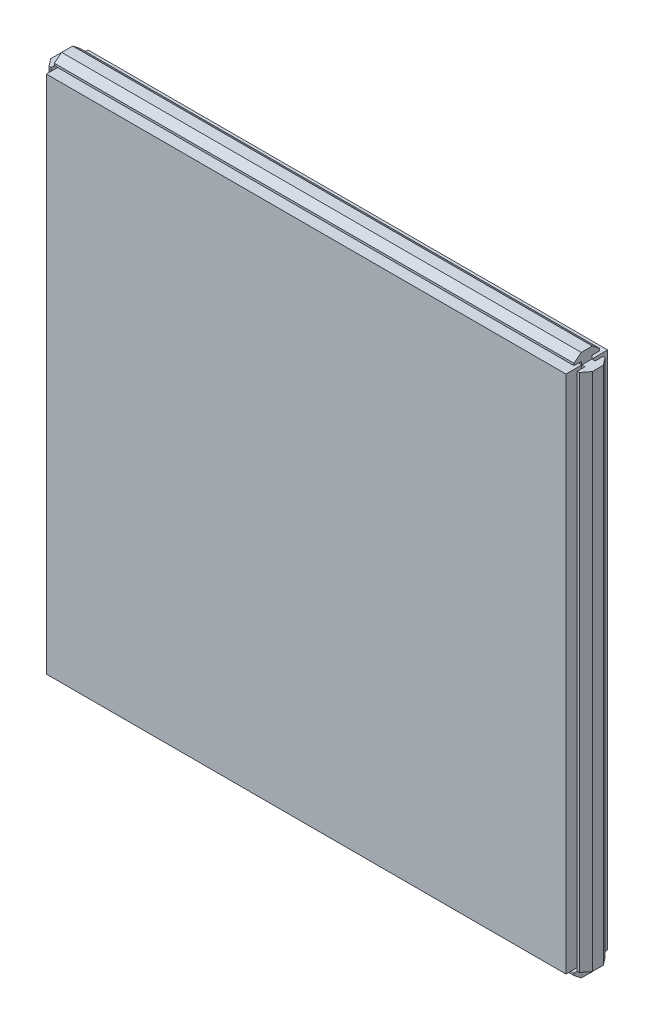
from build123d import *

# Parameters (mm, degrees)
BOSS_EXTRU_1_DEPTH           = 20
ENL_V_MAT_EXTRU_1_DEPTH      = 334.887542768
ENL_V_MAT_EXTRU_1_DEPTH_BACK = 249
ENL_V_MAT_EXTRU_2_DEPTH      = 334.887542768
ENL_V_MAT_EXTRU_2_DEPTH_BACK = 249
ENL_V_MAT_EXTRU_3_DEPTH      = 315.78213111
ENL_V_MAT_EXTRU_3_DEPTH_BACK = 249
ENL_V_MAT_EXTRU_4_DEPTH      = 315.78213111
ENL_V_MAT_EXTRU_4_DEPTH_BACK = 249
ENL_V_MAT_EXTRU_5_DEPTH      = 334.887542768
ENL_V_MAT_EXTRU_5_DEPTH_BACK = 249
ENL_V_MAT_EXTRU_6_DEPTH      = 334.887542768
ENL_V_MAT_EXTRU_6_DEPTH_BACK = 249
ENL_V_MAT_EXTRU_7_DEPTH      = 315.78213111
ENL_V_MAT_EXTRU_7_DEPTH_BACK = 249
ENL_V_MAT_EXTRU_8_DEPTH      = 315.78213111
ENL_V_MAT_EXTRU_8_DEPTH_BACK = 249


with BuildPart() as part:
    # Esquisse1 → Boss.-Extru.1 (new body)
    with BuildSketch(Plane.XY):
        Polygon((-179.143216373, 44.164624039), (69.856783627, 44.164624039), (69.856783627, 38.864624039), (75.156783627, 38.864624039), (75.156783627, -210.135375961), (69.856783627, -210.135375961), (69.856783627, -215.435375961), (-179.143216373, -215.435375961), (-179.143216373, -210.135375961), (-184.443216373, -210.135375961), (-184.443216373, 38.864624039), (-179.143216373, 38.864624039), align=None)
    extrude(amount=BOSS_EXTRU_1_DEPTH)

    # Esquisse2 → Enlèv. mat.-Extru.1 (cut, two sides: drawn at the far end of the back side and taken through both)
    with BuildSketch(Plane.ZY.offset(179.143216373).offset(-ENL_V_MAT_EXTRU_1_DEPTH_BACK)):
        Polygon((-529.816054004, 38.864624039), (0, 38.864624039), (7.55, 38.864624039), (7.55, 40.414624039), (3.85, 40.414624039), (3.85, 41.414624039), (7.35, 44.164624039), (423.954079466, 371.496400762), (75.014402763, 1372.026913212), (-878.755730707, 1039.395136489), align=None)
    extrude(amount=ENL_V_MAT_EXTRU_1_DEPTH + ENL_V_MAT_EXTRU_1_DEPTH_BACK, mode=Mode.SUBTRACT)

    # Esquisse3 → Enlèv. mat.-Extru.2 (cut, two sides: drawn at the far end of the back side and taken through both)
    with BuildSketch(Plane.ZY.offset(179.143216373).offset(-ENL_V_MAT_EXTRU_2_DEPTH_BACK)):
        Polygon((549.816054004, 38.864624039), (20, 38.864624039), (12.45, 38.864624039), (12.45, 40.414624039), (16.15, 40.414624039), (16.15, 41.414624039), (12.65, 44.164624039), (-403.954079466, 371.496400762), (-55.014402763, 1372.026913212), (898.755730707, 1039.395136489), align=None)
    extrude(amount=ENL_V_MAT_EXTRU_2_DEPTH + ENL_V_MAT_EXTRU_2_DEPTH_BACK, mode=Mode.SUBTRACT)

    # Esquisse5 → Enlèv. mat.-Extru.3 (cut, two sides: drawn at the far end of the back side and taken through both)
    with BuildSketch(Plane(origin=(0, -210.135375961, 0), x_dir=(-1, 0, 0), z_dir=(0, -1, 0)).offset(-ENL_V_MAT_EXTRU_3_DEPTH_BACK)):
        Polygon((179.143216373, 529.816054004), (179.143216373, 0), (179.143216373, -7.55), (180.693216373, -7.55), (180.693216373, -3.85), (181.693216373, -3.85), (184.443216373, -7.35), (511.774993096, -423.954079466), (1512.305505546, -75.014402763), (1179.673728823, 878.755730707), align=None)
    extrude(amount=ENL_V_MAT_EXTRU_3_DEPTH + ENL_V_MAT_EXTRU_3_DEPTH_BACK, mode=Mode.SUBTRACT)

    # Esquisse6 → Enlèv. mat.-Extru.4 (cut, two sides: drawn at the far end of the back side and taken through both)
    with BuildSketch(Plane(origin=(0, -210.135375961, 0), x_dir=(-1, 0, 0), z_dir=(0, -1, 0)).offset(-ENL_V_MAT_EXTRU_4_DEPTH_BACK)):
        Polygon((511.774993096, 403.954079466), (184.443216373, -12.65), (181.693216373, -16.15), (180.693216373, -16.15), (180.693216373, -12.45), (179.143216373, -12.45), (179.143216373, -20), (179.143216373, -549.816054004), (1179.673728823, -898.755730707), (1512.305505546, 55.014402763), align=None)
    extrude(amount=ENL_V_MAT_EXTRU_4_DEPTH + ENL_V_MAT_EXTRU_4_DEPTH_BACK, mode=Mode.SUBTRACT)

    # Esquisse8 → Enlèv. mat.-Extru.5 (cut, two sides: drawn at the far end of the back side and taken through both)
    with BuildSketch(Plane.ZY.offset(179.143216373).offset(-ENL_V_MAT_EXTRU_5_DEPTH_BACK)):
        Polygon((20, -210.135375961), (12.45, -210.135375961), (12.45, -211.685375961), (16.15, -211.685375961), (16.15, -212.685375961), (12.65, -215.435375961), (20, -215.435375961), align=None)
    extrude(amount=ENL_V_MAT_EXTRU_5_DEPTH + ENL_V_MAT_EXTRU_5_DEPTH_BACK, mode=Mode.SUBTRACT)

    # Esquisse9 → Enlèv. mat.-Extru.6 (cut, two sides: drawn at the far end of the back side and taken through both)
    with BuildSketch(Plane.ZY.offset(179.143216373).offset(-ENL_V_MAT_EXTRU_6_DEPTH_BACK)):
        Polygon((423.954079466, -542.767152684), (7.35, -215.435375961), (3.85, -212.685375961), (3.85, -211.685375961), (7.55, -211.685375961), (7.55, -210.135375961), (0, -210.135375961), (-529.816054004, -210.135375961), (-878.755730707, -1210.665888411), (75.014402763, -1543.297665134), align=None)
    extrude(amount=ENL_V_MAT_EXTRU_6_DEPTH + ENL_V_MAT_EXTRU_6_DEPTH_BACK, mode=Mode.SUBTRACT)

    # Esquisse11 → Enlèv. mat.-Extru.7 (cut, two sides: drawn at the far end of the back side and taken through both)
    with BuildSketch(Plane(origin=(0, 38.864624039, 0), x_dir=(1, 0, 0), z_dir=(0, 1, 0)).offset(-ENL_V_MAT_EXTRU_7_DEPTH_BACK)):
        Polygon((69.856783627, 0), (69.856783627, -7.55), (71.406783627, -7.55), (71.406783627, -3.85), (72.406783627, -3.85), (75.156783627, -7.35), (75.156783627, 0), align=None)
    extrude(amount=ENL_V_MAT_EXTRU_7_DEPTH + ENL_V_MAT_EXTRU_7_DEPTH_BACK, mode=Mode.SUBTRACT)

    # Esquisse12 → Enlèv. mat.-Extru.8 (cut, two sides: drawn at the far end of the back side and taken through both)
    with BuildSketch(Plane(origin=(0, 38.864624039, 0), x_dir=(1, 0, 0), z_dir=(0, 1, 0)).offset(-ENL_V_MAT_EXTRU_8_DEPTH_BACK)):
        Polygon((402.48856035, 403.954079466), (75.156783627, -12.65), (72.406783627, -16.15), (71.406783627, -16.15), (71.406783627, -12.45), (69.856783627, -12.45), (69.856783627, -20), (69.856783627, -549.816054004), (1070.387296077, -898.755730707), (1403.0190728, 55.014402763), align=None)
    extrude(amount=ENL_V_MAT_EXTRU_8_DEPTH + ENL_V_MAT_EXTRU_8_DEPTH_BACK, mode=Mode.SUBTRACT)


solid = part.part
